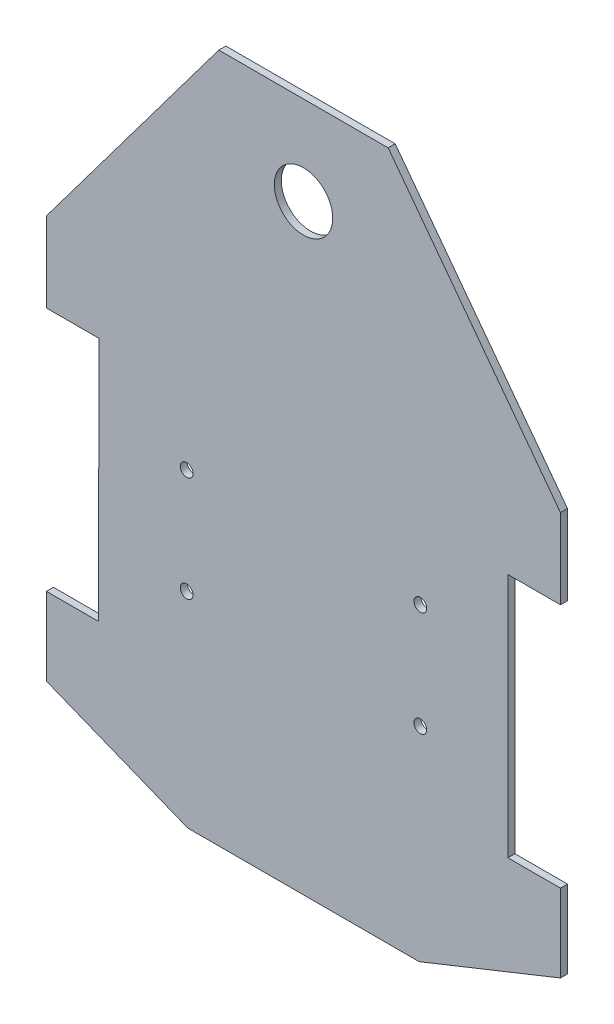
from build123d import *

# Parameters (mm, degrees)
SKETCH1_R           = 1.1
BOSS_EXTRUDE1_DEPTH = 1.2
SKETCH2_R           = 5
CUT_EXTRUDE1_DEPTH  = 74.610053661


with BuildPart() as part:
    # Sketch1 → Boss-Extrude1 (new body)
    with BuildSketch(Plane.XY):
        Polygon((-19.807417596, -59), (-44, -49.322967039), (-44, -36), (-35.109892996, -36), (-35, 6), (-44, 6), (-44, 19.666666667), (-14.5, 59), (14.5, 59), (44, 19.666666667), (44, 6), (35, 6), (35, -36), (44, -36), (44, -49.322967039), (19.807417596, -59), align=None)
        with Locations((-20, -6)):
            Circle(SKETCH1_R, mode=Mode.SUBTRACT)
        with Locations((-20, -24)):
            Circle(SKETCH1_R, mode=Mode.SUBTRACT)
        with Locations((20, -6)):
            Circle(SKETCH1_R, mode=Mode.SUBTRACT)
        with Locations((20, -24)):
            Circle(SKETCH1_R, mode=Mode.SUBTRACT)
    extrude(amount=BOSS_EXTRUDE1_DEPTH)

    # Sketch2 → Cut-Extrude1 (cut, through all)
    with BuildSketch(Plane.XY.offset(1.2)):
        with Locations((0, 43.808911543)):
            Circle(SKETCH2_R)
    extrude(amount=-CUT_EXTRUDE1_DEPTH, mode=Mode.SUBTRACT)


solid = part.part
